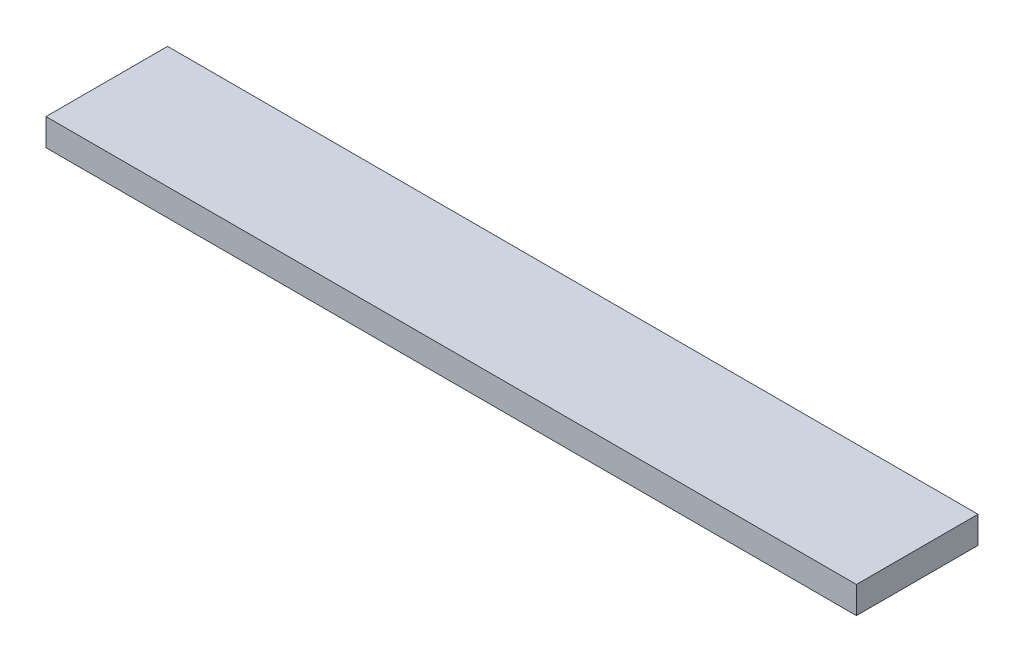
from build123d import *

# Parameters (mm, degrees)
SKETCH_1_W      = 300
SKETCH_1_H      = 45
EXTRUDE_1_DEPTH = 10


with BuildPart() as part:
    # 草图1 → 凸台-拉伸1 (new body)
    with BuildSketch(Plane(origin=(0, 0, 0), x_dir=(1, 0, 0), z_dir=(0, 1, 0))):
        Rectangle(SKETCH_1_W, SKETCH_1_H)
    extrude(amount=EXTRUDE_1_DEPTH)


solid = part.part
